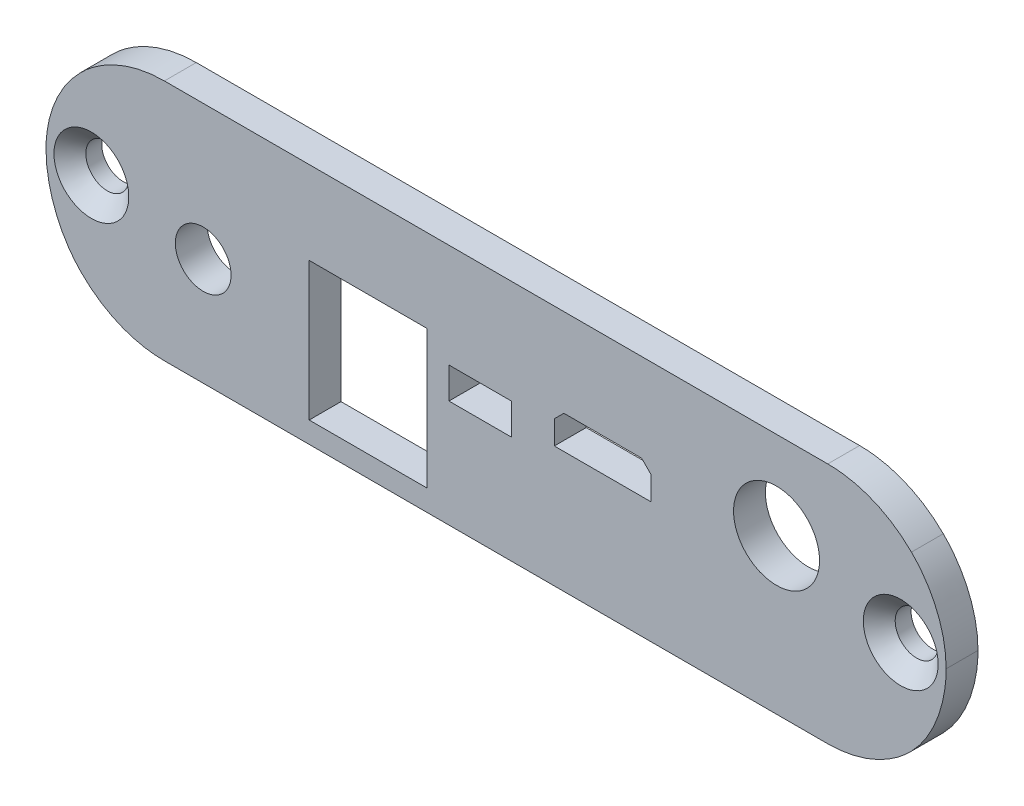
from build123d import *

# Parameters (mm, degrees)
SKETCH1_R           = 3.4289
SKETCH1_R_2         = 1.7144
SKETCH1_R_3         = 2.2226
SKETCH1_W           = 9.398
SKETCH1_H           = 11.0235
SKETCH1_W_2         = 5.0037
SKETCH1_H_2         = 2.4891
BOSS_EXTRUDE1_DEPTH = 2.54
CHAMFER1_SIZE       = 1.27


with BuildPart() as part:
    # Sketch1 → Boss-Extrude1 (new body)
    with BuildSketch(Plane.XY):
        with BuildLine():
            Line((6.434, 7.2517), (-46.4644, 7.2517))
            add(Edge.make_bspline(
                [(-46.4644, 7.2517), (-48.9654, 7.2501), (-51.3771, 6.2567), (-53.1462, 4.4876)],
                knots=[0.3, 0.3, 0.3, 0.3, 0.4, 0.4, 0.4, 0.4], degree=3))
            add(Edge.make_bspline(
                [(-53.1462, 4.4876), (-54.9139, 2.7201), (-55.907, 0.3228), (-55.9054, -2.1769)],
                knots=[0.4, 0.4, 0.4, 0.4, 0.5, 0.5, 0.5, 0.5], degree=3))
            add(Edge.make_bspline(
                [(-55.9054, -2.1769), (-55.9039, -4.7242), (-54.9188, -7.4291), (-53.137, -9.2518)],
                knots=[0.5, 0.5, 0.5, 0.5, 0.6, 0.6, 0.6, 0.6], degree=3))
            add(Edge.make_bspline(
                [(-53.137, -9.2518), (-51.3786, -11.0507), (-48.9824, -12.0793), (-46.4644, -12.0777)],
                knots=[0.6, 0.6, 0.6, 0.6, 0.7, 0.7, 0.7, 0.7], degree=3))
            Line((-46.4644, -12.0777), (6.434, -12.0777))
            add(Edge.make_bspline(
                [(6.434, -12.0777), (8.9516, -12.0761), (11.3581, -11.0449), (13.1151, -9.2429)],
                knots=[0.8, 0.8, 0.8, 0.8, 0.9, 0.9, 0.9, 0.9], degree=3))
            add(Edge.make_bspline(
                [(13.1151, -9.2429), (14.8954, -7.4173), (15.8766, -4.7239), (15.875, -2.1771)],
                knots=[0.9, 0.9, 0.9, 0.9, 1, 1, 1, 1], degree=3))
            add(Edge.make_bspline(
                [(15.875, -2.1771), (15.8735, 0.3223), (14.8775, 2.7305), (13.1074, 4.496)],
                knots=[0, 0, 0, 0, 0.1, 0.1, 0.1, 0.1], degree=3))
            add(Edge.make_bspline(
                [(13.1074, 4.496), (11.3364, 6.2625), (8.9354, 7.2533), (6.434, 7.2517)],
                knots=[0.1, 0.1, 0.1, 0.1, 0.2, 0.2, 0.2, 0.2], degree=3))
        make_face()
        with Locations((2.35, 0.25)):
            Circle(SKETCH1_R, mode=Mode.SUBTRACT)
        with Locations((12.2554, -2.1716)):
            Circle(SKETCH1_R_2, mode=Mode.SUBTRACT)
        with Locations((-43.3701, -3.5091)):
            Circle(SKETCH1_R_3, mode=Mode.SUBTRACT)
        with Locations((-52.2859, -2.1716)):
            Circle(SKETCH1_R_2, mode=Mode.SUBTRACT)
        with Locations((-30.2191, -4.88075)):
            Rectangle(SKETCH1_W, SKETCH1_H, mode=Mode.SUBTRACT)
        Polygon((-15.3715, -0.5328), (-14.6095, 0.2292), (-8.4119, 0.2292), (-7.6499, -0.5328), (-7.6499, -2.4124), (-15.3715, -2.4124), align=None, mode=Mode.SUBTRACT)
        with Locations((-21.27195, -2.26465)):
            Rectangle(SKETCH1_W_2, SKETCH1_H_2, mode=Mode.SUBTRACT)
    extrude(amount=BOSS_EXTRUDE1_DEPTH)

    # Chamfer1
    chamfer1_edges = [part.edges().sort_by_distance(p)[0] for p in [
        (10.541, -2.1716, 2.54),
        (-54.0003, -2.1716, 2.54),
    ]]
    chamfer(chamfer1_edges, length=CHAMFER1_SIZE)


solid = part.part
